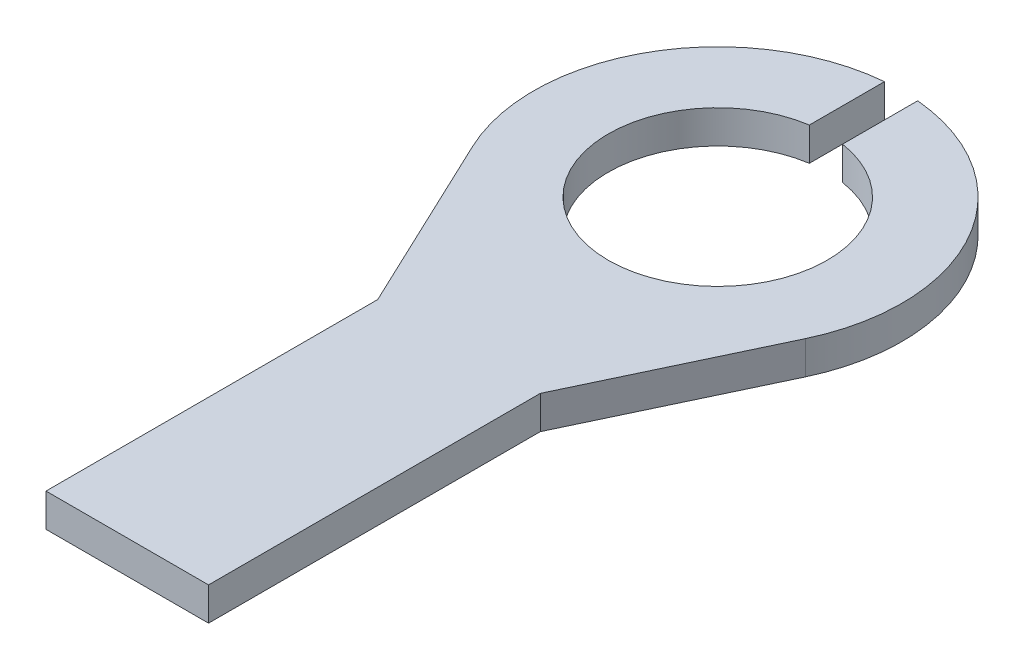
from build123d import *

# Parameters (mm, degrees)
BOSS_EXTRUDE1_DEPTH = 0.254


with BuildPart() as part:
    # Sketch1 → Boss-Extrude1 (new body)
    with BuildSketch(Plane(origin=(0, 0, 0), x_dir=(1, 0, 0), z_dir=(0, 1, 0))):
        with BuildLine():
            Line((0.6223, -1.9812), (1.274323937, -0.602787353))
            ThreePointArc((1.274323937, -0.602787353), (1.223802917, 0.699686009), (0.127, 1.403967624))
            Line((0.127, 1.403967624), (0.127, 0.828522927))
            ThreePointArc((0.127, 0.828522927), (0, -0.8382), (-0.127, 0.828522927))
            Line((-0.127, 0.828522927), (-0.127, 1.403967624))
            ThreePointArc((-0.127, 1.403967624), (-1.223802917, 0.699686009), (-1.274323937, -0.602787353))
            Line((-1.274323937, -0.602787353), (-0.6223, -1.9812))
            Line((-0.6223, -1.9812), (-0.6223, -4.5212))
            Line((-0.6223, -4.5212), (0.6223, -4.5212))
            Line((0.6223, -4.5212), (0.6223, -1.9812))
        make_face()
    extrude(amount=BOSS_EXTRUDE1_DEPTH)


solid = part.part
